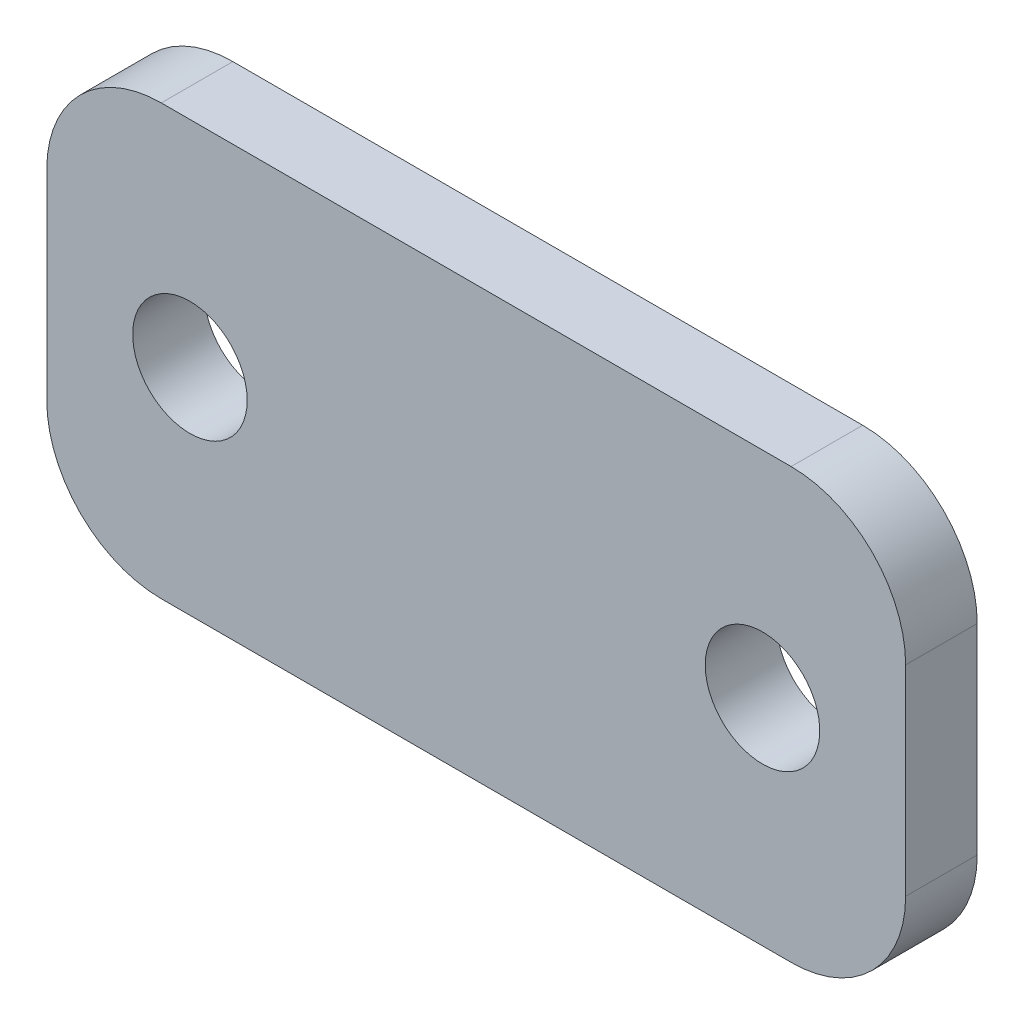
from build123d import *

# Parameters (mm, degrees)
SKETCH1_R           = 4
BOSS_EXTRUDE1_DEPTH = 5


with BuildPart() as part:
    # Sketch1 → Boss-Extrude1 (new body)
    with BuildSketch(Plane.XY):
        with BuildLine():
            Line((22, -15), (-22, -15))
            ThreePointArc((-22, -15), (-27.656854249, -12.656854249), (-30, -7))
            Line((-30, -7), (-30, 7))
            ThreePointArc((-30, 7), (-27.656854249, 12.656854249), (-22, 15))
            Line((-22, 15), (22, 15))
            ThreePointArc((22, 15), (27.656854249, 12.656854249), (30, 7))
            Line((30, 7), (30, -7))
            ThreePointArc((30, -7), (27.656854249, -12.656854249), (22, -15))
        make_face()
        with Locations((-20, 0)):
            Circle(SKETCH1_R, mode=Mode.SUBTRACT)
        with Locations(Location((20, 0, 0), (0, 0, 180))):
            Circle(SKETCH1_R, mode=Mode.SUBTRACT)
    extrude(amount=BOSS_EXTRUDE1_DEPTH)


solid = part.part
